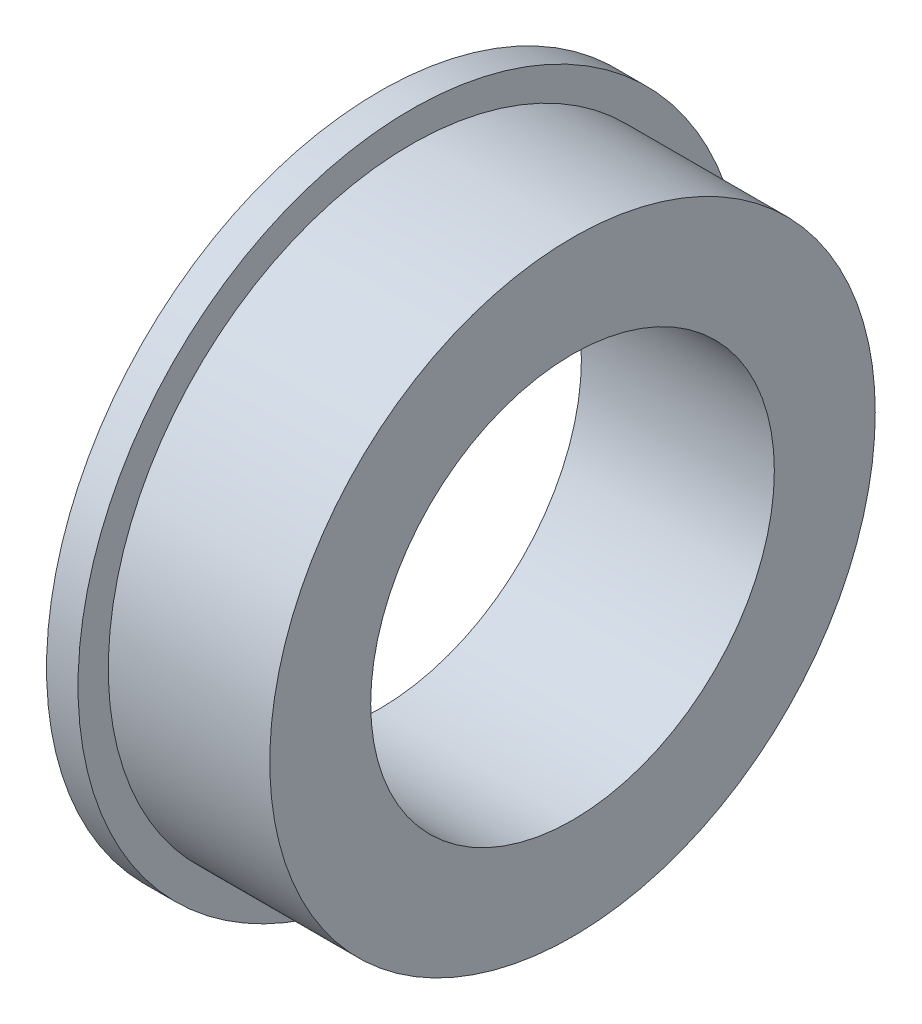
from build123d import *
from build123d.topology import SkipClean

# Parameters (mm, degrees)
SKETCH_1_R      = 7.5
SKETCH_1_R_2    = 5
EXTRUDE_3_DEPTH = 4
EXTRUDE_START   = 0.78
SKETCH_3_R      = 8.25
SKETCH_3_R_2    = 5
EXTRUDE_4_DEPTH = 0.78


with BuildPart() as part:
    # 草图1 → 凸台-拉伸3 (new body)
    with BuildSketch(Plane(origin=(0, 0, 0), x_dir=(0, 0, -1), z_dir=(1, 0, 0))):
        Circle(SKETCH_1_R)
        Circle(SKETCH_1_R_2, mode=Mode.SUBTRACT)
    extrude(amount=EXTRUDE_3_DEPTH)

    # 草图3 → 凸台-拉伸4 (add)
    with SkipClean():  # the faces are left unmerged after this step: merging them gives an invalid solid
        with BuildSketch(Plane.ZY.offset(EXTRUDE_START)):
            with Locations(Location((0, 0, 0), (0, 0, 180))):
                Circle(SKETCH_3_R)
            Circle(SKETCH_3_R_2, mode=Mode.SUBTRACT)
        extrude(amount=-EXTRUDE_4_DEPTH)


solid = part.part
